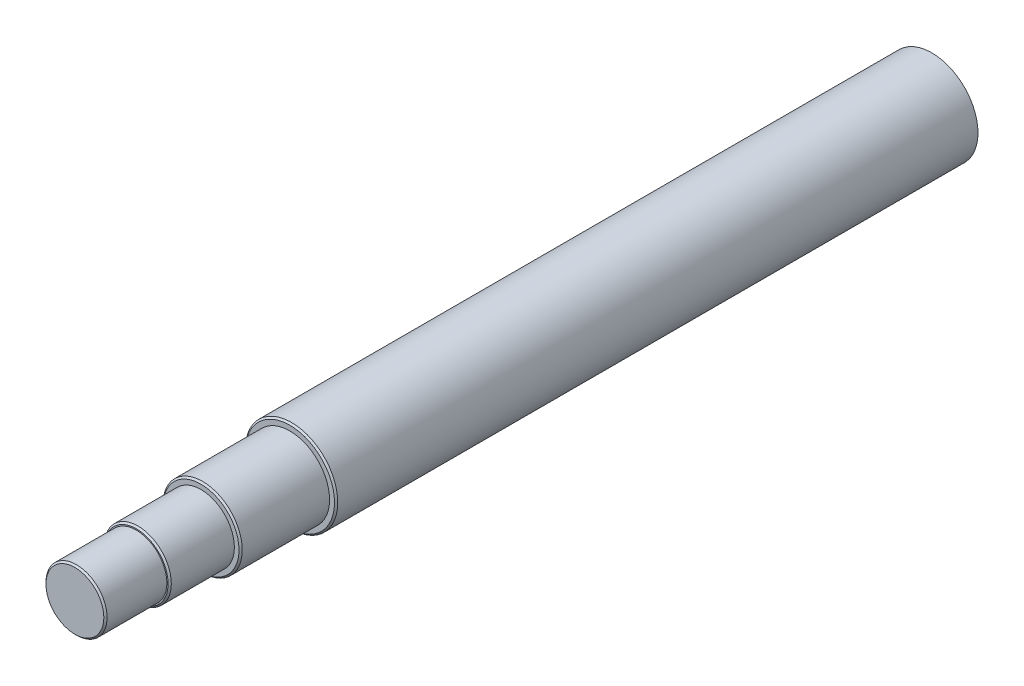
from build123d import *

# Parameters (mm, degrees)
SZKIC1_R                    = 28.575
DODANIE_WYCI_GNI_CIE1_DEPTH = 530
SZKIC2_OUTSIDE_W            = 166.376
SZKIC2_OUTSIDE_H            = 166.376
SZKIC2_OUTSIDE_R            = 18.9
WYTNIJ_WYCI_GNI_CIE1_DEPTH  = 38
SZKIC3_OUTSIDE_W            = 166.376
SZKIC3_OUTSIDE_H            = 166.376
SZKIC3_OUTSIDE_R            = 20.64
SZKIC3_OUTSIDE_R_2          = 18.9
WYTNIJ_WYCI_GNI_CIE2_DEPTH  = 40
SZKIC4_OUTSIDE_W            = 166.376
SZKIC4_OUTSIDE_H            = 166.376
SZKIC4_OUTSIDE_R            = 24.5
WYTNIJ_WYCI_GNI_CIE3_DEPTH  = 55
SZKIC5_R                    = 5
DODANIE_WYCI_GNI_CIE2_DEPTH = 5
SFAZOWANIE1_SIZE            = 1
SFAZOWANIE2_SIZE            = 1


with BuildPart() as part:
    # Szkic1 → Dodanie-wyciągnięcie1 (new body)
    with BuildSketch(Plane.XY):
        Circle(SZKIC1_R)
    extrude(amount=DODANIE_WYCI_GNI_CIE1_DEPTH)

    # Szkic2 outside → Wytnij-wyciągnięcie1 (cut)
    with BuildSketch(Plane.XY.offset(530)):
        Rectangle(SZKIC2_OUTSIDE_W, SZKIC2_OUTSIDE_H)
        Circle(SZKIC2_OUTSIDE_R, mode=Mode.SUBTRACT)
    extrude(amount=-WYTNIJ_WYCI_GNI_CIE1_DEPTH, mode=Mode.SUBTRACT)

    # Szkic3 outside → Wytnij-wyciągnięcie2 (cut)
    # profile 1 of 2: a face of its own
    with BuildSketch(Plane.XY.offset(492)):
        Rectangle(SZKIC3_OUTSIDE_W, SZKIC3_OUTSIDE_H)
        Circle(SZKIC3_OUTSIDE_R, mode=Mode.SUBTRACT)
    # profile 2 of 2: a face of its own
    with BuildSketch(Plane.XY.offset(492)):
        Circle(SZKIC3_OUTSIDE_R_2)
    extrude(amount=-WYTNIJ_WYCI_GNI_CIE2_DEPTH, mode=Mode.SUBTRACT)


with BuildPart() as wytnij_wyci_gni_cie2_piece_1:
    # of the separate pieces the step leaves, piece 1, a body of its own (wytnij_wyci_gni_cie2_pieces)
    add(part.part.solids().sort_by_distance((28.575, 0, 0))[0])

    # Szkic4 outside → Wytnij-wyciągnięcie3 (cut)
    with BuildSketch(Plane.XY.offset(452)):
        Rectangle(SZKIC4_OUTSIDE_W, SZKIC4_OUTSIDE_H)
        Circle(SZKIC4_OUTSIDE_R, mode=Mode.SUBTRACT)
    extrude(amount=-WYTNIJ_WYCI_GNI_CIE3_DEPTH, mode=Mode.SUBTRACT)

    # Szkic5 → Dodanie-wyciągnięcie2 (add)
    with BuildSketch(Plane(origin=(0, 0, 0), x_dir=(-1, 0, 0), z_dir=(0, 0, -1))):
        Circle(SZKIC5_R)
    extrude(amount=DODANIE_WYCI_GNI_CIE2_DEPTH)

    # Sfazowanie2
    sfazowanie2_edges = [wytnij_wyci_gni_cie2_piece_1.edges().sort_by_distance(p)[0] for p in [
        (-28.575, 0, 397),
        (-24.5, 0, 452),
        (-20.64, 0, 492),
    ]]
    chamfer(sfazowanie2_edges, length=SFAZOWANIE2_SIZE)


with BuildPart() as wytnij_wyci_gni_cie2_piece_2:
    # of the separate pieces the step leaves, piece 2, a body of its own (wytnij_wyci_gni_cie2_pieces)
    add(part.part.solids().sort_by_distance((18.9, 0, 530))[0])

    # Sfazowanie1
    sfazowanie1_edges = [wytnij_wyci_gni_cie2_piece_2.edges().sort_by_distance(p)[0] for p in [
        (-18.9, 0, 530),
    ]]
    chamfer(sfazowanie1_edges, length=SFAZOWANIE1_SIZE)


solid = Compound([wytnij_wyci_gni_cie2_piece_1.part, wytnij_wyci_gni_cie2_piece_2.part])
